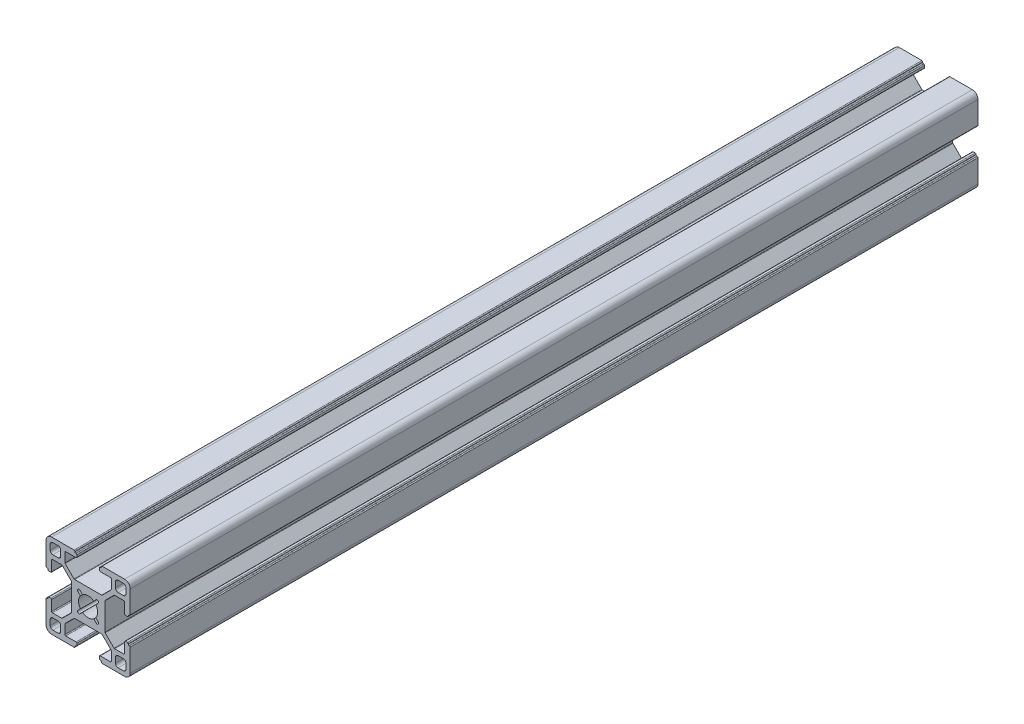
from build123d import *

# Parameters (mm, degrees)
ESTRUSIONE_ESTRUSIONE1_DEPTH = 302


with BuildPart() as part:
    # Schizzo1 → Estrusione-Estrusione1 (new body)
    with BuildSketch(Plane.XY.offset(25)):
        with BuildLine():
            Line((-4.7, -14.7), (-4.7, -14.6))
            ThreePointArc((-4.7, -14.6), (-4.612132034, -14.387867966), (-4.4, -14.3))
            Line((-4.4, -14.3), (-4.3, -14.3))
            ThreePointArc((-4.3, -14.3), (-4.087867966, -14.212132034), (-4, -14))
            Line((-4, -14), (-4, -13.3))
            ThreePointArc((-4, -13.3), (-4.087867966, -13.087867966), (-4.3, -13))
            Line((-4.3, -13), (-7.95, -13))
            ThreePointArc((-7.95, -13), (-8.162132034, -12.912132034), (-8.25, -12.7))
            Line((-8.25, -12.7), (-8.25, -9.43492424))
            ThreePointArc((-8.25, -9.43492424), (-8.22716386, -9.320119211), (-8.162132034, -9.222792206))
            Line((-8.162132034, -9.222792206), (-5.027207794, -6.087867966))
            ThreePointArc((-5.027207794, -6.087867966), (-4.929880789, -6.02283614), (-4.81507576, -6))
            Line((-4.81507576, -6), (4.81507576, -6))
            ThreePointArc((4.81507576, -6), (4.929880789, -6.02283614), (5.027207794, -6.087867966))
            Line((5.027207794, -6.087867966), (8.162132034, -9.222792206))
            ThreePointArc((8.162132034, -9.222792206), (8.22716386, -9.320119211), (8.25, -9.43492424))
            Line((8.25, -9.43492424), (8.25, -12.7))
            ThreePointArc((8.25, -12.7), (8.162132034, -12.912132034), (7.95, -13))
            Line((7.95, -13), (4.3, -13))
            ThreePointArc((4.3, -13), (4.087867966, -13.087867966), (4, -13.3))
            Line((4, -13.3), (4, -14))
            ThreePointArc((4, -14), (4.087867966, -14.212132034), (4.3, -14.3))
            Line((4.3, -14.3), (4.4, -14.3))
            ThreePointArc((4.4, -14.3), (4.612132034, -14.387867966), (4.7, -14.6))
            Line((4.7, -14.6), (4.7, -14.7))
            ThreePointArc((4.7, -14.7), (4.787867966, -14.912132034), (5, -15))
            Line((5, -15), (13, -15))
            ThreePointArc((13, -15), (14.414213562, -14.414213562), (15, -13))
            Line((15, -13), (15, -5))
            ThreePointArc((15, -5), (14.912132034, -4.787867966), (14.7, -4.7))
            Line((14.7, -4.7), (14.6, -4.7))
            ThreePointArc((14.6, -4.7), (14.387867966, -4.612132034), (14.3, -4.4))
            Line((14.3, -4.4), (14.3, -4.3))
            ThreePointArc((14.3, -4.3), (14.212132034, -4.087867966), (14, -4))
            Line((14, -4), (13.3, -4))
            ThreePointArc((13.3, -4), (13.087867966, -4.087867966), (13, -4.3))
            Line((13, -4.3), (13, -7.95))
            ThreePointArc((13, -7.95), (12.912132034, -8.162132034), (12.7, -8.25))
            Line((12.7, -8.25), (9.43492424, -8.25))
            ThreePointArc((9.43492424, -8.25), (9.320119211, -8.22716386), (9.222792206, -8.162132034))
            Line((9.222792206, -8.162132034), (6.087867966, -5.027207794))
            ThreePointArc((6.087867966, -5.027207794), (6.02283614, -4.929880789), (6, -4.81507576))
            Line((6, -4.81507576), (6, 4.81507576))
            ThreePointArc((6, 4.81507576), (6.02283614, 4.929880789), (6.087867966, 5.027207794))
            Line((6.087867966, 5.027207794), (9.222792206, 8.162132034))
            ThreePointArc((9.222792206, 8.162132034), (9.320119211, 8.22716386), (9.43492424, 8.25))
            Line((9.43492424, 8.25), (12.7, 8.25))
            ThreePointArc((12.7, 8.25), (12.912132034, 8.162132034), (13, 7.95))
            Line((13, 7.95), (13, 4.3))
            ThreePointArc((13, 4.3), (13.087867966, 4.087867966), (13.3, 4))
            Line((13.3, 4), (14, 4))
            ThreePointArc((14, 4), (14.212132034, 4.087867966), (14.3, 4.3))
            Line((14.3, 4.3), (14.3, 4.4))
            ThreePointArc((14.3, 4.4), (14.387867966, 4.612132034), (14.6, 4.7))
            Line((14.6, 4.7), (14.7, 4.7))
            ThreePointArc((14.7, 4.7), (14.912132034, 4.787867966), (15, 5))
            Line((15, 5), (15, 13))
            ThreePointArc((15, 13), (14.414213562, 14.414213562), (13, 15))
            Line((13, 15), (5, 15))
            ThreePointArc((5, 15), (4.787867966, 14.912132034), (4.7, 14.7))
            Line((4.7, 14.7), (4.7, 14.6))
            ThreePointArc((4.7, 14.6), (4.612132034, 14.387867966), (4.4, 14.3))
            Line((4.4, 14.3), (4.3, 14.3))
            ThreePointArc((4.3, 14.3), (4.087867966, 14.212132034), (4, 14))
            Line((4, 14), (4, 13.3))
            ThreePointArc((4, 13.3), (4.087867966, 13.087867966), (4.3, 13))
            Line((4.3, 13), (7.95, 13))
            ThreePointArc((7.95, 13), (8.162132034, 12.912132034), (8.25, 12.7))
            Line((8.25, 12.7), (8.25, 9.43492424))
            ThreePointArc((8.25, 9.43492424), (8.22716386, 9.320119211), (8.162132034, 9.222792206))
            Line((8.162132034, 9.222792206), (5.027207794, 6.087867966))
            ThreePointArc((5.027207794, 6.087867966), (4.929880789, 6.02283614), (4.81507576, 6))
            Line((4.81507576, 6), (-4.81507576, 6))
            ThreePointArc((-4.81507576, 6), (-4.929880789, 6.02283614), (-5.027207794, 6.087867966))
            Line((-5.027207794, 6.087867966), (-8.162132034, 9.222792206))
            ThreePointArc((-8.162132034, 9.222792206), (-8.22716386, 9.320119211), (-8.25, 9.43492424))
            Line((-8.25, 9.43492424), (-8.25, 12.7))
            ThreePointArc((-8.25, 12.7), (-8.162132034, 12.912132034), (-7.95, 13))
            Line((-7.95, 13), (-4.3, 13))
            ThreePointArc((-4.3, 13), (-4.087867966, 13.087867966), (-4, 13.3))
            Line((-4, 13.3), (-4, 14))
            ThreePointArc((-4, 14), (-4.087867966, 14.212132034), (-4.3, 14.3))
            Line((-4.3, 14.3), (-4.4, 14.3))
            ThreePointArc((-4.4, 14.3), (-4.612132034, 14.387867966), (-4.7, 14.6))
            Line((-4.7, 14.6), (-4.7, 14.7))
            ThreePointArc((-4.7, 14.7), (-4.787867966, 14.912132034), (-5, 15))
            Line((-5, 15), (-13, 15))
            ThreePointArc((-13, 15), (-14.414213562, 14.414213562), (-15, 13))
            Line((-15, 13), (-15, 5))
            ThreePointArc((-15, 5), (-14.912132034, 4.787867966), (-14.7, 4.7))
            Line((-14.7, 4.7), (-14.6, 4.7))
            ThreePointArc((-14.6, 4.7), (-14.387867966, 4.612132034), (-14.3, 4.4))
            Line((-14.3, 4.4), (-14.3, 4.3))
            ThreePointArc((-14.3, 4.3), (-14.212132034, 4.087867966), (-14, 4))
            Line((-14, 4), (-13.3, 4))
            ThreePointArc((-13.3, 4), (-13.087867966, 4.087867966), (-13, 4.3))
            Line((-13, 4.3), (-13, 7.95))
            ThreePointArc((-13, 7.95), (-12.912132034, 8.162132034), (-12.7, 8.25))
            Line((-12.7, 8.25), (-9.43492424, 8.25))
            ThreePointArc((-9.43492424, 8.25), (-9.320119211, 8.22716386), (-9.222792206, 8.162132034))
            Line((-9.222792206, 8.162132034), (-6.087867966, 5.027207794))
            ThreePointArc((-6.087867966, 5.027207794), (-6.02283614, 4.929880789), (-6, 4.81507576))
            Line((-6, 4.81507576), (-6, -4.81507576))
            ThreePointArc((-6, -4.81507576), (-6.02283614, -4.929880789), (-6.087867966, -5.027207794))
            Line((-6.087867966, -5.027207794), (-9.222792206, -8.162132034))
            ThreePointArc((-9.222792206, -8.162132034), (-9.320119211, -8.22716386), (-9.43492424, -8.25))
            Line((-9.43492424, -8.25), (-12.7, -8.25))
            ThreePointArc((-12.7, -8.25), (-12.912132034, -8.162132034), (-13, -7.95))
            Line((-13, -7.95), (-13, -4.3))
            ThreePointArc((-13, -4.3), (-13.087867966, -4.087867966), (-13.3, -4))
            Line((-13.3, -4), (-14, -4))
            ThreePointArc((-14, -4), (-14.212132034, -4.087867966), (-14.3, -4.3))
            Line((-14.3, -4.3), (-14.3, -4.4))
            ThreePointArc((-14.3, -4.4), (-14.387867966, -4.612132034), (-14.6, -4.7))
            Line((-14.6, -4.7), (-14.7, -4.7))
            ThreePointArc((-14.7, -4.7), (-14.912132034, -4.787867966), (-15, -5))
            Line((-15, -5), (-15, -13))
            ThreePointArc((-15, -13), (-14.414213562, -14.414213562), (-13, -15))
            Line((-13, -15), (-5, -15))
            ThreePointArc((-5, -15), (-4.787867966, -14.912132034), (-4.7, -14.7))
        make_face()
        with BuildLine():
            Line((-12.5625, -9.75), (-10.6875, -9.75))
            ThreePointArc((-10.6875, -9.75), (-10.024587393, -10.024587393), (-9.75, -10.6875))
            Line((-9.75, -10.6875), (-9.75, -12.5625))
            ThreePointArc((-9.75, -12.5625), (-10.024587393, -13.225412607), (-10.6875, -13.5))
            Line((-10.6875, -13.5), (-12.5625, -13.5))
            ThreePointArc((-12.5625, -13.5), (-13.225412607, -13.225412607), (-13.5, -12.5625))
            Line((-13.5, -12.5625), (-13.5, -10.6875))
            ThreePointArc((-13.5, -10.6875), (-13.225412607, -10.024587393), (-12.5625, -9.75))
        make_face(mode=Mode.SUBTRACT)
        with BuildLine():
            Line((12.5625, 9.75), (10.6875, 9.75))
            ThreePointArc((10.6875, 9.75), (10.024587393, 10.024587393), (9.75, 10.6875))
            Line((9.75, 10.6875), (9.75, 12.5625))
            ThreePointArc((9.75, 12.5625), (10.024587393, 13.225412607), (10.6875, 13.5))
            Line((10.6875, 13.5), (12.5625, 13.5))
            ThreePointArc((12.5625, 13.5), (13.225412607, 13.225412607), (13.5, 12.5625))
            Line((13.5, 12.5625), (13.5, 10.6875))
            ThreePointArc((13.5, 10.6875), (13.225412607, 10.024587393), (12.5625, 9.75))
        make_face(mode=Mode.SUBTRACT)
        with BuildLine():
            Line((2.010111251, 2.742162059), (2.867949192, 3.6))
            ThreePointArc((2.867949192, 3.6), (3.6, 3.6), (3.6, 2.867949192))
            Line((3.6, 2.867949192), (2.742162059, 2.010111251))
            ThreePointArc((2.742162059, 2.010111251), (3.4, 0), (2.742162059, -2.010111251))
            Line((2.742162059, -2.010111251), (3.6, -2.867949192))
            ThreePointArc((3.6, -2.867949192), (3.6, -3.6), (2.867949192, -3.6))
            Line((2.867949192, -3.6), (2.010111251, -2.742162059))
            ThreePointArc((2.010111251, -2.742162059), (0, -3.4), (-2.010111251, -2.742162059))
            Line((-2.010111251, -2.742162059), (-2.867949192, -3.6))
            ThreePointArc((-2.867949192, -3.6), (-3.6, -3.6), (-3.6, -2.867949192))
            Line((-3.6, -2.867949192), (-2.742162059, -2.010111251))
            ThreePointArc((-2.742162059, -2.010111251), (-3.4, 0), (-2.742162059, 2.010111251))
            Line((-2.742162059, 2.010111251), (-3.6, 2.867949192))
            ThreePointArc((-3.6, 2.867949192), (-3.6, 3.6), (-2.867949192, 3.6))
            Line((-2.867949192, 3.6), (-2.010111251, 2.742162059))
            ThreePointArc((-2.010111251, 2.742162059), (0, 3.4), (2.010111251, 2.742162059))
        make_face(mode=Mode.SUBTRACT)
        with BuildLine():
            Line((-9.75, 12.5625), (-9.75, 10.6875))
            ThreePointArc((-9.75, 10.6875), (-10.024587393, 10.024587393), (-10.6875, 9.75))
            Line((-10.6875, 9.75), (-12.5625, 9.75))
            ThreePointArc((-12.5625, 9.75), (-13.225412607, 10.024587393), (-13.5, 10.6875))
            Line((-13.5, 10.6875), (-13.5, 12.5625))
            ThreePointArc((-13.5, 12.5625), (-13.225412607, 13.225412607), (-12.5625, 13.5))
            Line((-12.5625, 13.5), (-10.6875, 13.5))
            ThreePointArc((-10.6875, 13.5), (-10.024587393, 13.225412607), (-9.75, 12.5625))
        make_face(mode=Mode.SUBTRACT)
        with BuildLine():
            Line((9.75, -12.5625), (9.75, -10.6875))
            ThreePointArc((9.75, -10.6875), (10.024587393, -10.024587393), (10.6875, -9.75))
            Line((10.6875, -9.75), (12.5625, -9.75))
            ThreePointArc((12.5625, -9.75), (13.225412607, -10.024587393), (13.5, -10.6875))
            Line((13.5, -10.6875), (13.5, -12.5625))
            ThreePointArc((13.5, -12.5625), (13.225412607, -13.225412607), (12.5625, -13.5))
            Line((12.5625, -13.5), (10.6875, -13.5))
            ThreePointArc((10.6875, -13.5), (10.024587393, -13.225412607), (9.75, -12.5625))
        make_face(mode=Mode.SUBTRACT)
    extrude(amount=-ESTRUSIONE_ESTRUSIONE1_DEPTH)


solid = part.part
